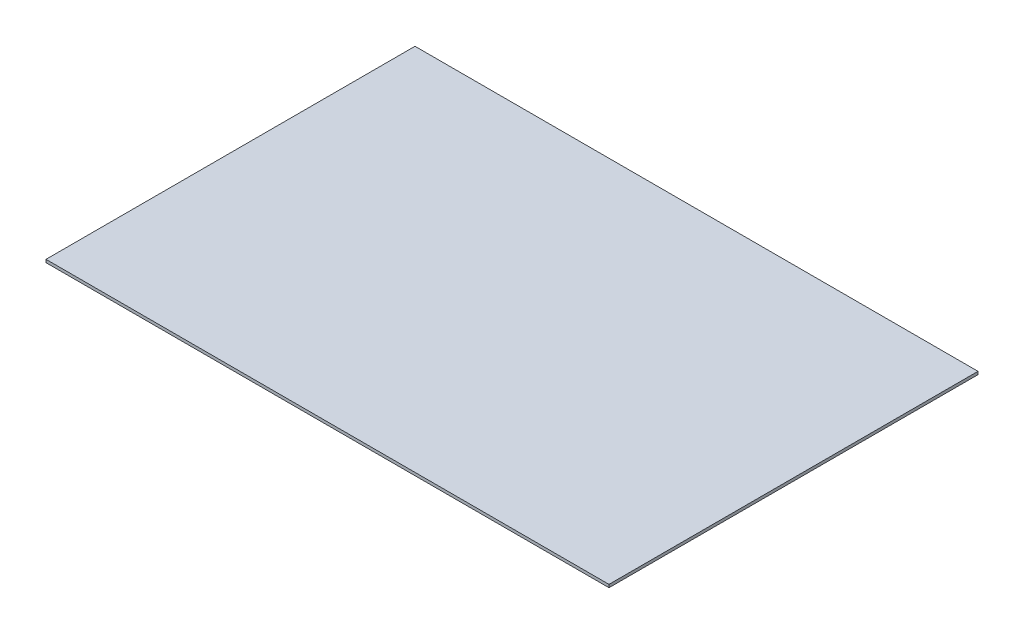
from build123d import *

# Parameters (mm, degrees)
SKETCH1_W           = 386
SKETCH1_H           = 253
BOSS_EXTRUDE1_DEPTH = 2


with BuildPart() as part:
    # Sketch1 → Boss-Extrude1 (new body)
    with BuildSketch(Plane(origin=(0, 0, 0), x_dir=(1, 0, 0), z_dir=(0, 1, 0))):
        with Locations((-2, 1)):
            Rectangle(SKETCH1_W, SKETCH1_H)
    extrude(amount=BOSS_EXTRUDE1_DEPTH)


solid = part.part
